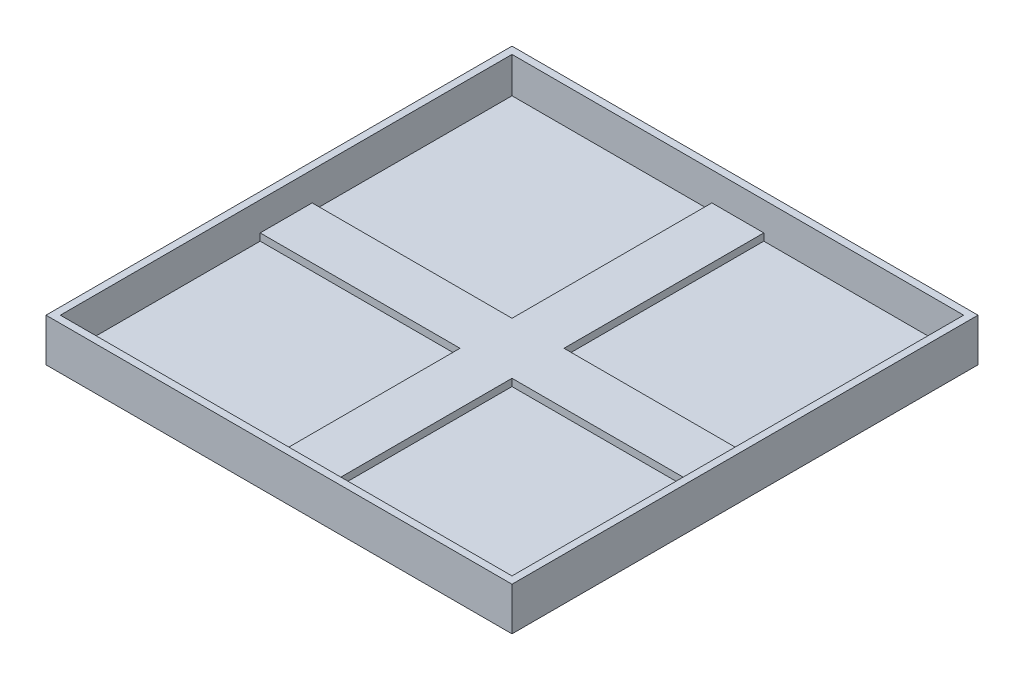
from build123d import *

# Parameters (mm, degrees)
SKETCH1_W           = 252
SKETCH1_H           = 252
BOSS_EXTRUDE1_DEPTH = 4
SKETCH2_W           = 252
SKETCH2_H           = 29
SKETCH2_W_2         = 29
SKETCH2_H_2         = 252
BOSS_EXTRUDE2_DEPTH = 4
SKETCH3_W           = 260
SKETCH3_H           = 260
SKETCH3_W_2         = 252
SKETCH3_H_2         = 252
BOSS_EXTRUDE3_DEPTH = 24


with BuildPart() as part:
    # Sketch1 → Boss-Extrude1 (new body)
    with BuildSketch(Plane(origin=(0, 0, 0), x_dir=(1, 0, 0), z_dir=(0, 1, 0))):
        Rectangle(SKETCH1_W, SKETCH1_H)
    extrude(amount=BOSS_EXTRUDE1_DEPTH)

    # Sketch2 → Boss-Extrude2 (add)
    with BuildSketch(Plane(origin=(0, 4, 0), x_dir=(1, 0, 0), z_dir=(0, 1, 0))):
        Rectangle(SKETCH2_W, SKETCH2_H)
        Rectangle(SKETCH2_W_2, SKETCH2_H_2)
    extrude(amount=BOSS_EXTRUDE2_DEPTH)

    # Sketch3 → Boss-Extrude3 (add)
    with BuildSketch(Plane.XZ):
        Rectangle(SKETCH3_W, SKETCH3_H)
        Rectangle(SKETCH3_W_2, SKETCH3_H_2, mode=Mode.SUBTRACT)
    extrude(amount=-BOSS_EXTRUDE3_DEPTH)


solid = part.part
